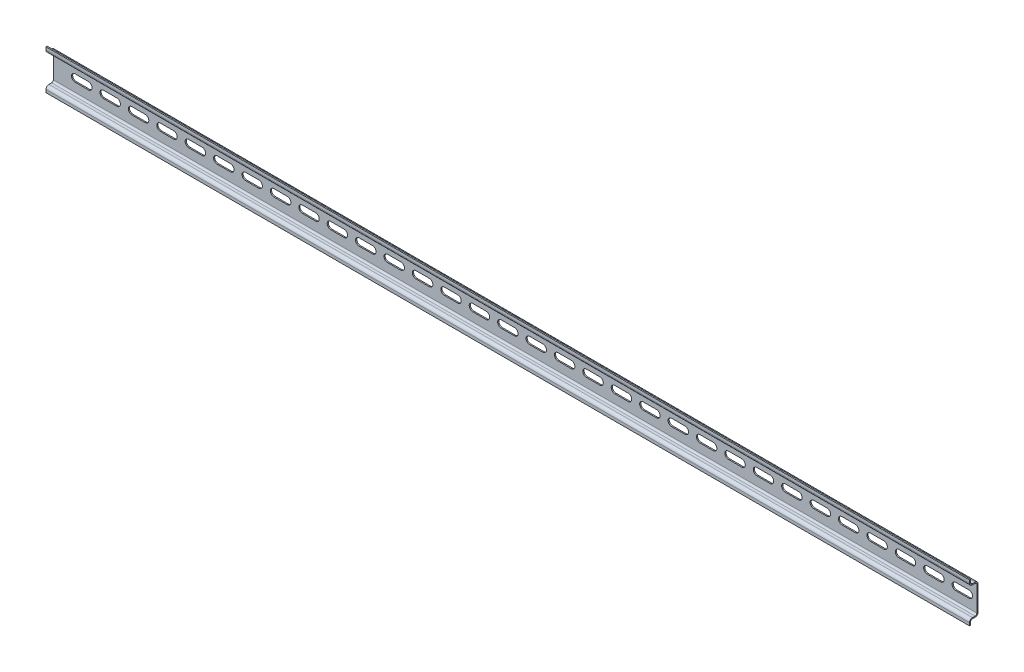
from build123d import *

# Parameters (mm, degrees)
BOSS_EXTRUDE1_DEPTH     = 1000
CUT_EXTRUDE1_DEPTH      = 1001.181688833
FILLET1_R               = 2.54
FILLET2_R               = 1.524
CUT_EXTRUDE2_DEPTH      = 1001.181688833
CUT_EXTRUDE2_DEPTH_BACK = 1001.181688833
SKETCH3_W               = 187.2
SKETCH3_H               = 35.052


with BuildPart() as part:
    # Sketch1 → Boss-Extrude1 (new body)
    with BuildSketch(Plane(origin=(0, 0, 0), x_dir=(0, 0, -1), z_dir=(1, 0, 0))):
        Polygon((0, 12.446), (0, -12.446), (-6.484, -12.446), (-6.484, -17.526), (-5.484, -17.526), (-5.484, -13.462), (1.016, -13.462), (1.016, 13.462), (-5.484, 13.462), (-5.484, 17.526), (-6.484, 17.526), (-6.484, 12.446), align=None)
    extrude(amount=BOSS_EXTRUDE1_DEPTH)

    # Sketch2 → Cut-Extrude1 (cut, through all)
    with BuildSketch(Plane(origin=(0, 0, -1.016), x_dir=(-1, 0, 0), z_dir=(0, 0, -1))):
        with BuildLine():
            Line((-980.825, 3.175), (-969.175, 3.175))
            ThreePointArc((-969.175, 3.175), (-966, 0), (-969.175, -3.175))
            Line((-969.175, -3.175), (-980.825, -3.175))
            ThreePointArc((-980.825, -3.175), (-984, 0), (-980.825, 3.175))
        make_face()
        with BuildLine():
            Line((-955.824999962, 3.175), (-944.174999962, 3.175))
            ThreePointArc((-944.174999962, 3.175), (-940.999999962, 0), (-944.174999962, -3.175))
            Line((-944.174999962, -3.175), (-955.824999962, -3.175))
            ThreePointArc((-955.824999962, -3.175), (-958.999999962, 0), (-955.824999962, 3.175))
        make_face()
        with BuildLine():
            Line((-930.824999924, 3.175), (-919.174999924, 3.175))
            ThreePointArc((-919.174999924, 3.175), (-915.999999924, 0), (-919.174999924, -3.175))
            Line((-919.174999924, -3.175), (-930.824999924, -3.175))
            ThreePointArc((-930.824999924, -3.175), (-933.999999924, 0), (-930.824999924, 3.175))
        make_face()
        with BuildLine():
            Line((-905.824999886, 3.175), (-894.174999886, 3.175))
            ThreePointArc((-894.174999886, 3.175), (-890.999999886, 0), (-894.174999886, -3.175))
            Line((-894.174999886, -3.175), (-905.824999886, -3.175))
            ThreePointArc((-905.824999886, -3.175), (-908.999999886, 0), (-905.824999886, 3.175))
        make_face()
        with BuildLine():
            Line((-880.824999848, 3.175), (-869.174999848, 3.175))
            ThreePointArc((-869.174999848, 3.175), (-865.999999848, 0), (-869.174999848, -3.175))
            Line((-869.174999848, -3.175), (-880.824999848, -3.175))
            ThreePointArc((-880.824999848, -3.175), (-883.999999848, 0), (-880.824999848, 3.175))
        make_face()
        with BuildLine():
            Line((-855.82499981, 3.175), (-844.17499981, 3.175))
            ThreePointArc((-844.17499981, 3.175), (-840.99999981, 0), (-844.17499981, -3.175))
            Line((-844.17499981, -3.175), (-855.82499981, -3.175))
            ThreePointArc((-855.82499981, -3.175), (-858.99999981, 0), (-855.82499981, 3.175))
        make_face()
        with BuildLine():
            Line((-830.824999772, 3.175), (-819.174999772, 3.175))
            ThreePointArc((-819.174999772, 3.175), (-815.999999772, 0), (-819.174999772, -3.175))
            Line((-819.174999772, -3.175), (-830.824999772, -3.175))
            ThreePointArc((-830.824999772, -3.175), (-833.999999772, 0), (-830.824999772, 3.175))
        make_face()
        with BuildLine():
            Line((-805.824999734, 3.175), (-794.174999734, 3.175))
            ThreePointArc((-794.174999734, 3.175), (-790.999999734, 0), (-794.174999734, -3.175))
            Line((-794.174999734, -3.175), (-805.824999734, -3.175))
            ThreePointArc((-805.824999734, -3.175), (-808.999999734, 0), (-805.824999734, 3.175))
        make_face()
        with BuildLine():
            Line((-780.824999696, 3.175), (-769.174999696, 3.175))
            ThreePointArc((-769.174999696, 3.175), (-765.999999696, 0), (-769.174999696, -3.175))
            Line((-769.174999696, -3.175), (-780.824999696, -3.175))
            ThreePointArc((-780.824999696, -3.175), (-783.999999696, 0), (-780.824999696, 3.175))
        make_face()
        with BuildLine():
            Line((-755.824999658, 3.175), (-744.174999658, 3.175))
            ThreePointArc((-744.174999658, 3.175), (-740.999999658, 0), (-744.174999658, -3.175))
            Line((-744.174999658, -3.175), (-755.824999658, -3.175))
            ThreePointArc((-755.824999658, -3.175), (-758.999999658, 0), (-755.824999658, 3.175))
        make_face()
        with BuildLine():
            Line((-730.82499962, 3.175), (-719.17499962, 3.175))
            ThreePointArc((-719.17499962, 3.175), (-715.99999962, 0), (-719.17499962, -3.175))
            Line((-719.17499962, -3.175), (-730.82499962, -3.175))
            ThreePointArc((-730.82499962, -3.175), (-733.99999962, 0), (-730.82499962, 3.175))
        make_face()
        with BuildLine():
            Line((-705.824999582, 3.175), (-694.174999582, 3.175))
            ThreePointArc((-694.174999582, 3.175), (-690.999999582, 0), (-694.174999582, -3.175))
            Line((-694.174999582, -3.175), (-705.824999582, -3.175))
            ThreePointArc((-705.824999582, -3.175), (-708.999999582, 0), (-705.824999582, 3.175))
        make_face()
        with BuildLine():
            Line((-680.824999544, 3.175), (-669.174999544, 3.175))
            ThreePointArc((-669.174999544, 3.175), (-665.999999544, 0), (-669.174999544, -3.175))
            Line((-669.174999544, -3.175), (-680.824999544, -3.175))
            ThreePointArc((-680.824999544, -3.175), (-683.999999544, 0), (-680.824999544, 3.175))
        make_face()
        with BuildLine():
            Line((-655.824999506, 3.175), (-644.174999506, 3.175))
            ThreePointArc((-644.174999506, 3.175), (-640.999999506, 0), (-644.174999506, -3.175))
            Line((-644.174999506, -3.175), (-655.824999506, -3.175))
            ThreePointArc((-655.824999506, -3.175), (-658.999999506, 0), (-655.824999506, 3.175))
        make_face()
        with BuildLine():
            Line((-630.824999468, 3.175), (-619.174999468, 3.175))
            ThreePointArc((-619.174999468, 3.175), (-615.999999468, 0), (-619.174999468, -3.175))
            Line((-619.174999468, -3.175), (-630.824999468, -3.175))
            ThreePointArc((-630.824999468, -3.175), (-633.999999468, 0), (-630.824999468, 3.175))
        make_face()
        with BuildLine():
            Line((-605.82499943, 3.175), (-594.17499943, 3.175))
            ThreePointArc((-594.17499943, 3.175), (-590.99999943, 0), (-594.17499943, -3.175))
            Line((-594.17499943, -3.175), (-605.82499943, -3.175))
            ThreePointArc((-605.82499943, -3.175), (-608.99999943, 0), (-605.82499943, 3.175))
        make_face()
        with BuildLine():
            Line((-580.824999392, 3.175), (-569.174999392, 3.175))
            ThreePointArc((-569.174999392, 3.175), (-565.999999392, 0), (-569.174999392, -3.175))
            Line((-569.174999392, -3.175), (-580.824999392, -3.175))
            ThreePointArc((-580.824999392, -3.175), (-583.999999392, 0), (-580.824999392, 3.175))
        make_face()
        with BuildLine():
            Line((-555.824999354, 3.175), (-544.174999354, 3.175))
            ThreePointArc((-544.174999354, 3.175), (-540.999999354, 0), (-544.174999354, -3.175))
            Line((-544.174999354, -3.175), (-555.824999354, -3.175))
            ThreePointArc((-555.824999354, -3.175), (-558.999999354, 0), (-555.824999354, 3.175))
        make_face()
        with BuildLine():
            Line((-530.824999316, 3.175), (-519.174999316, 3.175))
            ThreePointArc((-519.174999316, 3.175), (-515.999999316, 0), (-519.174999316, -3.175))
            Line((-519.174999316, -3.175), (-530.824999316, -3.175))
            ThreePointArc((-530.824999316, -3.175), (-533.999999316, 0), (-530.824999316, 3.175))
        make_face()
        with BuildLine():
            Line((-505.824999278, 3.175), (-494.174999278, 3.175))
            ThreePointArc((-494.174999278, 3.175), (-490.999999278, 0), (-494.174999278, -3.175))
            Line((-494.174999278, -3.175), (-505.824999278, -3.175))
            ThreePointArc((-505.824999278, -3.175), (-508.999999278, 0), (-505.824999278, 3.175))
        make_face()
        with BuildLine():
            Line((-480.82499924, 3.175), (-469.17499924, 3.175))
            ThreePointArc((-469.17499924, 3.175), (-465.99999924, 0), (-469.17499924, -3.175))
            Line((-469.17499924, -3.175), (-480.82499924, -3.175))
            ThreePointArc((-480.82499924, -3.175), (-483.99999924, 0), (-480.82499924, 3.175))
        make_face()
        with BuildLine():
            Line((-455.824999202, 3.175), (-444.174999202, 3.175))
            ThreePointArc((-444.174999202, 3.175), (-440.999999202, 0), (-444.174999202, -3.175))
            Line((-444.174999202, -3.175), (-455.824999202, -3.175))
            ThreePointArc((-455.824999202, -3.175), (-458.999999202, 0), (-455.824999202, 3.175))
        make_face()
        with BuildLine():
            Line((-430.824999164, 3.175), (-419.174999164, 3.175))
            ThreePointArc((-419.174999164, 3.175), (-415.999999164, 0), (-419.174999164, -3.175))
            Line((-419.174999164, -3.175), (-430.824999164, -3.175))
            ThreePointArc((-430.824999164, -3.175), (-433.999999164, 0), (-430.824999164, 3.175))
        make_face()
        with BuildLine():
            Line((-405.824999126, 3.175), (-394.174999126, 3.175))
            ThreePointArc((-394.174999126, 3.175), (-390.999999126, 0), (-394.174999126, -3.175))
            Line((-394.174999126, -3.175), (-405.824999126, -3.175))
            ThreePointArc((-405.824999126, -3.175), (-408.999999126, 0), (-405.824999126, 3.175))
        make_face()
        with BuildLine():
            Line((-380.824999088, 3.175), (-369.174999088, 3.175))
            ThreePointArc((-369.174999088, 3.175), (-365.999999088, 0), (-369.174999088, -3.175))
            Line((-369.174999088, -3.175), (-380.824999088, -3.175))
            ThreePointArc((-380.824999088, -3.175), (-383.999999088, 0), (-380.824999088, 3.175))
        make_face()
        with BuildLine():
            Line((-355.82499905, 3.175), (-344.17499905, 3.175))
            ThreePointArc((-344.17499905, 3.175), (-340.99999905, 0), (-344.17499905, -3.175))
            Line((-344.17499905, -3.175), (-355.82499905, -3.175))
            ThreePointArc((-355.82499905, -3.175), (-358.99999905, 0), (-355.82499905, 3.175))
        make_face()
        with BuildLine():
            Line((-330.824999012, 3.175), (-319.174999012, 3.175))
            ThreePointArc((-319.174999012, 3.175), (-315.999999012, 0), (-319.174999012, -3.175))
            Line((-319.174999012, -3.175), (-330.824999012, -3.175))
            ThreePointArc((-330.824999012, -3.175), (-333.999999012, 0), (-330.824999012, 3.175))
        make_face()
        with BuildLine():
            Line((-305.824998974, 3.175), (-294.174998974, 3.175))
            ThreePointArc((-294.174998974, 3.175), (-290.999998974, 0), (-294.174998974, -3.175))
            Line((-294.174998974, -3.175), (-305.824998974, -3.175))
            ThreePointArc((-305.824998974, -3.175), (-308.999998974, 0), (-305.824998974, 3.175))
        make_face()
        with BuildLine():
            Line((-280.824998936, 3.175), (-269.174998936, 3.175))
            ThreePointArc((-269.174998936, 3.175), (-265.999998936, 0), (-269.174998936, -3.175))
            Line((-269.174998936, -3.175), (-280.824998936, -3.175))
            ThreePointArc((-280.824998936, -3.175), (-283.999998936, 0), (-280.824998936, 3.175))
        make_face()
        with BuildLine():
            Line((-255.824998898, 3.175), (-244.174998898, 3.175))
            ThreePointArc((-244.174998898, 3.175), (-240.999998898, 0), (-244.174998898, -3.175))
            Line((-244.174998898, -3.175), (-255.824998898, -3.175))
            ThreePointArc((-255.824998898, -3.175), (-258.999998898, 0), (-255.824998898, 3.175))
        make_face()
        with BuildLine():
            Line((-230.82499886, 3.175), (-219.17499886, 3.175))
            ThreePointArc((-219.17499886, 3.175), (-215.99999886, 0), (-219.17499886, -3.175))
            Line((-219.17499886, -3.175), (-230.82499886, -3.175))
            ThreePointArc((-230.82499886, -3.175), (-233.99999886, 0), (-230.82499886, 3.175))
        make_face()
        with BuildLine():
            Line((-205.824998822, 3.175), (-194.174998822, 3.175))
            ThreePointArc((-194.174998822, 3.175), (-190.999998822, 0), (-194.174998822, -3.175))
            Line((-194.174998822, -3.175), (-205.824998822, -3.175))
            ThreePointArc((-205.824998822, -3.175), (-208.999998822, 0), (-205.824998822, 3.175))
        make_face()
        with BuildLine():
            Line((-180.824998784, 3.175), (-169.174998784, 3.175))
            ThreePointArc((-169.174998784, 3.175), (-165.999998784, 0), (-169.174998784, -3.175))
            Line((-169.174998784, -3.175), (-180.824998784, -3.175))
            ThreePointArc((-180.824998784, -3.175), (-183.999998784, 0), (-180.824998784, 3.175))
        make_face()
        with BuildLine():
            Line((-155.824998746, 3.175), (-144.174998746, 3.175))
            ThreePointArc((-144.174998746, 3.175), (-140.999998746, 0), (-144.174998746, -3.175))
            Line((-144.174998746, -3.175), (-155.824998746, -3.175))
            ThreePointArc((-155.824998746, -3.175), (-158.999998746, 0), (-155.824998746, 3.175))
        make_face()
        with BuildLine():
            Line((-130.824998708, 3.175), (-119.174998708, 3.175))
            ThreePointArc((-119.174998708, 3.175), (-115.999998708, 0), (-119.174998708, -3.175))
            Line((-119.174998708, -3.175), (-130.824998708, -3.175))
            ThreePointArc((-130.824998708, -3.175), (-133.999998708, 0), (-130.824998708, 3.175))
        make_face()
        with BuildLine():
            Line((-105.82499867, 3.175), (-94.17499867, 3.175))
            ThreePointArc((-94.17499867, 3.175), (-90.99999867, 0), (-94.17499867, -3.175))
            Line((-94.17499867, -3.175), (-105.82499867, -3.175))
            ThreePointArc((-105.82499867, -3.175), (-108.99999867, 0), (-105.82499867, 3.175))
        make_face()
        with BuildLine():
            Line((-80.824998632, 3.175), (-69.174998632, 3.175))
            ThreePointArc((-69.174998632, 3.175), (-65.999998632, 0), (-69.174998632, -3.175))
            Line((-69.174998632, -3.175), (-80.824998632, -3.175))
            ThreePointArc((-80.824998632, -3.175), (-83.999998632, 0), (-80.824998632, 3.175))
        make_face()
        with BuildLine():
            Line((-55.824998594, 3.175), (-44.174998594, 3.175))
            ThreePointArc((-44.174998594, 3.175), (-40.999998594, 0), (-44.174998594, -3.175))
            Line((-44.174998594, -3.175), (-55.824998594, -3.175))
            ThreePointArc((-55.824998594, -3.175), (-58.999998594, 0), (-55.824998594, 3.175))
        make_face()
        with BuildLine():
            Line((-30.824998556, 3.175), (-19.174998556, 3.175))
            ThreePointArc((-19.174998556, 3.175), (-15.999998556, 0), (-19.174998556, -3.175))
            Line((-19.174998556, -3.175), (-30.824998556, -3.175))
            ThreePointArc((-30.824998556, -3.175), (-33.999998556, 0), (-30.824998556, 3.175))
        make_face()
    extrude(amount=-CUT_EXTRUDE1_DEPTH, mode=Mode.SUBTRACT)

    # Fillet1
    fillet1_edges = [part.edges().sort_by_distance(p)[0] for p in [
        (500, 13.462, -1.016),
        (500, -13.462, -1.016),
        (500, -12.446, 6.484),
        (500, 12.446, 6.484),
    ]]
    fillet(fillet1_edges, radius=FILLET1_R)

    # Fillet2
    fillet2_edges = [part.edges().sort_by_distance(p)[0] for p in [
        (500, 13.462, 5.484),
        (500, -13.462, 5.484),
        (500, -12.446, 0),
        (500, 12.446, 0),
    ]]
    fillet(fillet2_edges, radius=FILLET2_R)

    # Sketch3 → Cut-Extrude2 (cut, two sides: drawn at the far end of the back side and taken through both)
    with BuildSketch(Plane(origin=(0, 0, -1.016), x_dir=(-1, 0, 0), z_dir=(0, 0, -1)).offset(-CUT_EXTRUDE2_DEPTH_BACK)):
        with Locations((-906.4, 0)):
            Rectangle(SKETCH3_W, SKETCH3_H)
    extrude(amount=CUT_EXTRUDE2_DEPTH + CUT_EXTRUDE2_DEPTH_BACK, mode=Mode.SUBTRACT)


solid = part.part
